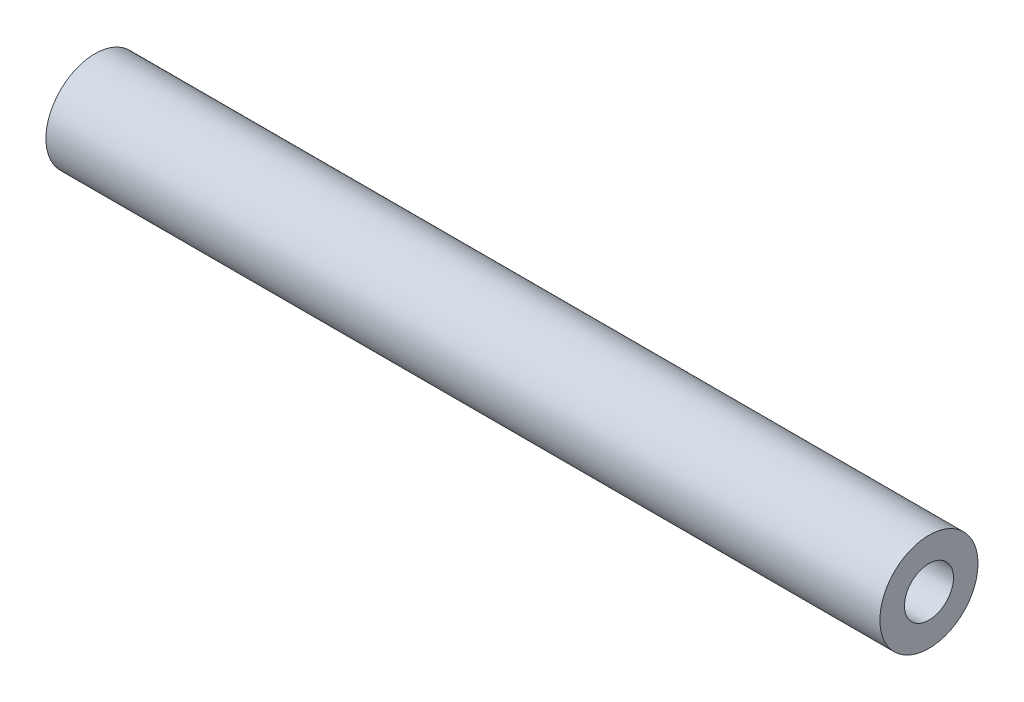
from build123d import *

# Parameters (mm, degrees)
SKETCH2_R           = 5
SKETCH2_R_2         = 2.5
BOSS_EXTRUDE1_DEPTH = 85


with BuildPart() as part:
    # Sketch2 → Boss-Extrude1 (new body)
    with BuildSketch(Plane(origin=(0, 0, 0), x_dir=(0, 0, -1), z_dir=(1, 0, 0))):
        Circle(SKETCH2_R)
        Circle(SKETCH2_R_2, mode=Mode.SUBTRACT)
    extrude(amount=BOSS_EXTRUDE1_DEPTH)


solid = part.part
